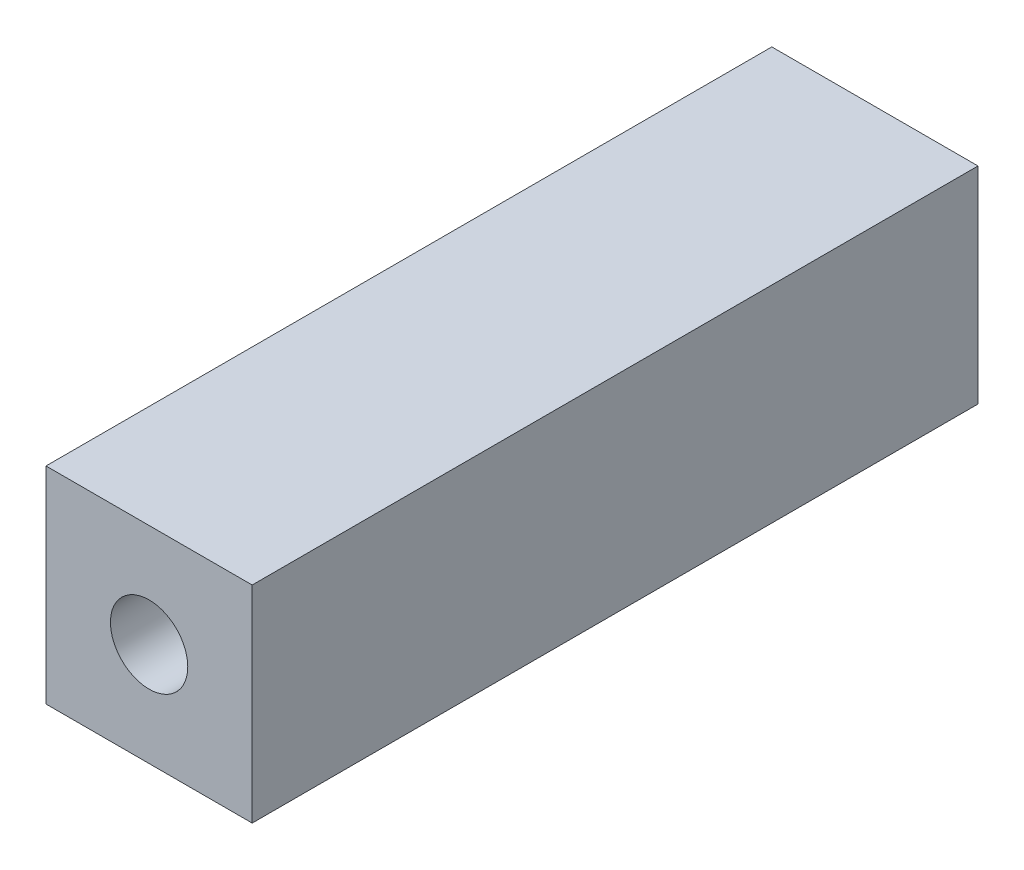
from build123d import *

# Parameters (mm, degrees)
SKETCH1_W                        = 25.4
SKETCH1_H                        = 25.4
BOSS_EXTRUDE1_DEPTH              = 89.408
F_3_8_0_375_DIAMETER_HOLE1_D     = 9.525
F_3_8_0_375_DIAMETER_HOLE1_DEPTH = 25.4
F_3_8_0_375_DIAMETER_HOLE1_TIP   = 2.861598698
F_3_8_0_375_DIAMETER_HOLE2_D     = 9.525
F_3_8_0_375_DIAMETER_HOLE2_DEPTH = 25.4
F_3_8_0_375_DIAMETER_HOLE2_TIP   = 2.861598698


with BuildPart() as part:
    # Sketch1 → Boss-Extrude1 (new body)
    with BuildSketch(Plane.XY):
        with Locations((12.7, 12.7)):
            Rectangle(SKETCH1_W, SKETCH1_H)
    extrude(amount=BOSS_EXTRUDE1_DEPTH)

    # 3/8 (0.375) Diameter Hole1
    with Locations(Plane(origin=(0, 0, 0), x_dir=(-1, 0, 0), z_dir=(0, 0, -1))):
        with Locations((-12.7, 12.7)):
            Hole(F_3_8_0_375_DIAMETER_HOLE1_D / 2, depth=F_3_8_0_375_DIAMETER_HOLE1_DEPTH)
            with Locations((0, 0, -(F_3_8_0_375_DIAMETER_HOLE1_DEPTH + F_3_8_0_375_DIAMETER_HOLE1_TIP / 2))):  # 118° drill point
                Cone(0, F_3_8_0_375_DIAMETER_HOLE1_D / 2, F_3_8_0_375_DIAMETER_HOLE1_TIP, mode=Mode.SUBTRACT)

    # 3/8 (0.375) Diameter Hole2
    with Locations(Plane.XY.offset(89.408)):
        with Locations((12.7, 12.7)):
            Hole(F_3_8_0_375_DIAMETER_HOLE2_D / 2, depth=F_3_8_0_375_DIAMETER_HOLE2_DEPTH)
            with Locations((0, 0, -(F_3_8_0_375_DIAMETER_HOLE2_DEPTH + F_3_8_0_375_DIAMETER_HOLE2_TIP / 2))):  # 118° drill point
                Cone(0, F_3_8_0_375_DIAMETER_HOLE2_D / 2, F_3_8_0_375_DIAMETER_HOLE2_TIP, mode=Mode.SUBTRACT)


solid = part.part
